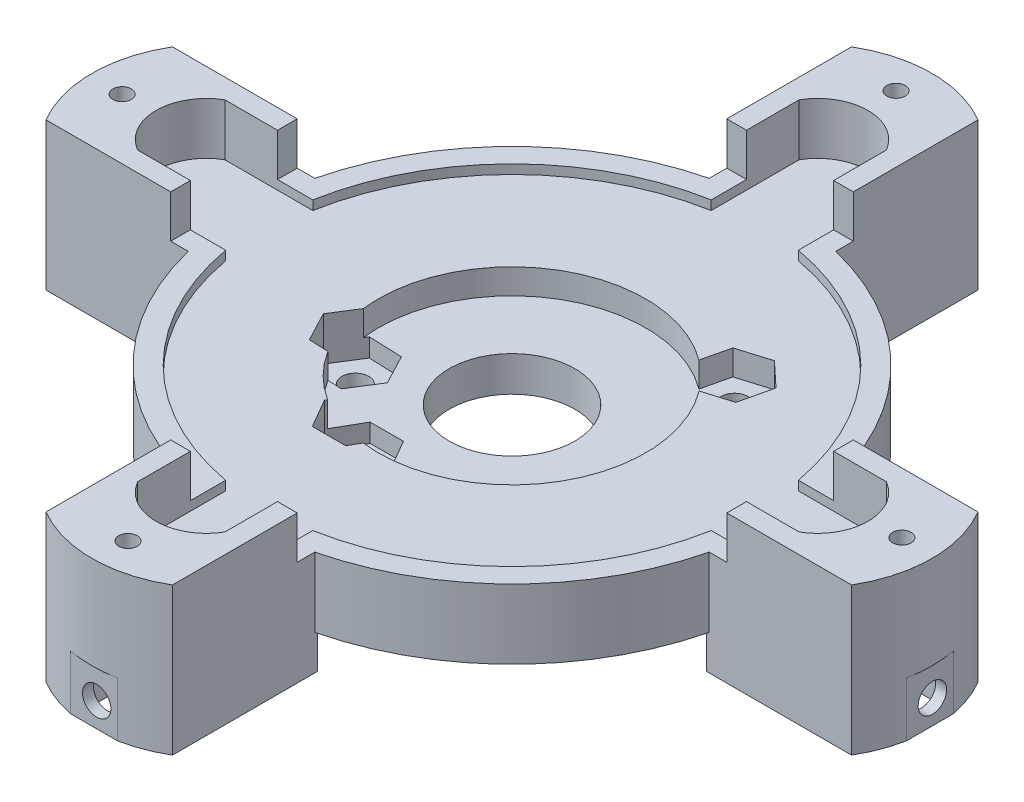
from build123d import *

# Parameters (mm, degrees)
SKETCH1_R                = 32
BOSS_EXTRUDE1_DEPTH      = 8.3
BOSS_EXTRUDE2_DEPTH      = 5.1
BOSS_EXTRUDE2_DEPTH_BACK = 12.5
CUT_EXTRUDE1_START       = -1.1
CUT_EXTRUDE1_DEPTH       = 6.2
SKETCH3_R                = 15.95
CUT_EXTRUDE2_DEPTH       = 3
CUT_EXTRUDE3_REACH       = 73.529
SKETCH4_R                = 7.5
CUT_EXTRUDE4_DEPTH       = 3
CUT_EXTRUDE5_REACH       = 74.189
SKETCH5_3_R              = 1.6
CUT_EXTRUDE6_DEPTH       = 3
CUT_EXTRUDE7_START       = -2.2
CUT_EXTRUDE7_DEPTH       = 5.2
SKETCH10_W               = 66.4
SKETCH10_H               = 66.4
CUT_EXTRUDE8_DEPTH       = 5.1
CUT_EXTRUDE9_REACH       = 75.085
SKETCH11_R               = 1.1
SKETCH12_W               = 4.8
SKETCH12_H               = 5.3
SKETCH12_W_2             = 5.3
SKETCH12_H_2             = 4.8
CUT_EXTRUDE10_DEPTH      = 12.6
SKETCH13_W               = 6.3
SKETCH13_H               = 2.5
SKETCH13_W_2             = 2.5
SKETCH13_H_2             = 6.3
CUT_EXTRUDE11_DEPTH      = 6.5
SKETCH14_R               = 1.7
CUT_EXTRUDE12_DEPTH      = 3.5
SKETCH15_W               = 6.3
SKETCH15_H               = 2.5
CUT_EXTRUDE13_DEPTH      = 7.6
CIRPATTERN1_COUNT        = 4
CUT_EXTRUDE14_DEPTH      = 6.5
SKETCH17_R               = 1.7
CUT_EXTRUDE15_DEPTH      = 9
CIRPATTERN9_COUNT        = 4


with BuildPart() as part:
    # Sketch1 → Boss-Extrude1 (new body)
    with BuildSketch(Plane(origin=(0, 0, 0), x_dir=(1, 0, 0), z_dir=(0, 1, 0))):
        with Locations(Location((0, 0, 0), (0, 0, 90))):
            Circle(SKETCH1_R)
    extrude(amount=BOSS_EXTRUDE1_DEPTH)

    # Sketch6 → Boss-Extrude2 (add, two sides: drawn at the far end of the back side and taken through both)
    with BuildSketch(Plane(origin=(0, 8.3, 0), x_dir=(1, 0, 0), z_dir=(0, 1, 0)).offset(-BOSS_EXTRUDE2_DEPTH_BACK)):
        with BuildLine():
            Line((-7.55, 48.087781667), (-7.55, 30.787781667))
            Line((-7.55, 30.787781667), (7.55, 30.787781667))
            Line((7.55, 30.787781667), (7.55, 48.087781667))
            ThreePointArc((7.55, 48.087781667), (0, 50.158386552), (-7.55, 48.087781667))
        make_face()
        with BuildLine():
            Line((30.787781667, 7.55), (30.787781667, -7.55))
            Line((30.787781667, -7.55), (48.087781667, -7.55))
            ThreePointArc((48.087781667, -7.55), (50.158386552, 0), (48.087781667, 7.55))
            Line((48.087781667, 7.55), (30.787781667, 7.55))
        make_face()
        with BuildLine():
            Line((7.55, -30.787781667), (-7.55, -30.787781667))
            Line((-7.55, -30.787781667), (-7.55, -48.087781667))
            ThreePointArc((-7.55, -48.087781667), (0, -50.158386552), (7.55, -48.087781667))
            Line((7.55, -48.087781667), (7.55, -30.787781667))
        make_face()
        with BuildLine():
            Line((-30.787781667, -7.55), (-30.787781667, 7.55))
            Line((-30.787781667, 7.55), (-48.087781667, 7.55))
            ThreePointArc((-48.087781667, 7.55), (-50.158386552, 0), (-48.087781667, -7.55))
            Line((-48.087781667, -7.55), (-30.787781667, -7.55))
        make_face()
    extrude(amount=BOSS_EXTRUDE2_DEPTH + BOSS_EXTRUDE2_DEPTH_BACK)

    # Sketch2 → Cut-Extrude1 (cut)
    with BuildSketch(Plane(origin=(0, 8.3, 0), x_dir=(1, 0, 0), z_dir=(0, 1, 0)).offset(CUT_EXTRUDE1_START)):
        with BuildLine():
            Line((28.987281694, -5.2), (39.487281694, -5.2))
            ThreePointArc((39.487281694, -5.2), (42.493955784, 0), (39.487281694, 5.2))
            Line((39.487281694, 5.2), (28.987281694, 5.2))
            ThreePointArc((28.987281694, 5.2), (20.824294706, 20.824294706), (5.2, 28.987281694))
            Line((5.2, 28.987281694), (5.2, 39.487281694))
            ThreePointArc((5.2, 39.487281694), (0, 42.493955784), (-5.2, 39.487281694))
            Line((-5.2, 39.487281694), (-5.2, 28.987281694))
            ThreePointArc((-5.2, 28.987281694), (-20.824294706, 20.824294706), (-28.987281694, 5.2))
            Line((-28.987281694, 5.2), (-39.487281694, 5.2))
            ThreePointArc((-39.487281694, 5.2), (-42.493955784, 0), (-39.487281694, -5.2))
            Line((-39.487281694, -5.2), (-28.987281694, -5.2))
            ThreePointArc((-28.987281694, -5.2), (-20.824294706, -20.824294706), (-5.2, -28.987281694))
            Line((-5.2, -28.987281694), (-5.2, -39.487281694))
            ThreePointArc((-5.2, -39.487281694), (0, -42.493955784), (5.2, -39.487281694))
            Line((5.2, -39.487281694), (5.2, -28.987281694))
            ThreePointArc((5.2, -28.987281694), (20.824294706, -20.824294706), (28.987281694, -5.2))
        make_face()
    extrude(amount=CUT_EXTRUDE1_DEPTH, mode=Mode.SUBTRACT)

    # Sketch3 → Cut-Extrude2 (cut)
    with BuildSketch(Plane(origin=(0, 7.2, 0), x_dir=(1, 0, 0), z_dir=(0, 1, 0))):
        with Locations(Location((0, 0, 0), (0, 0, 270))):
            Circle(SKETCH3_R)
    extrude(amount=-CUT_EXTRUDE2_DEPTH, mode=Mode.SUBTRACT)

    # Sketch4 → Cut-Extrude3 (cut, up to next)
    with BuildSketch(Plane(origin=(0, 4.2, 0), x_dir=(1, 0, 0), z_dir=(0, 1, 0)), mode=Mode.PRIVATE) as cut_extrude3_sk1:
        with Locations(Location((0, 0, 0), (0, 0, 270))):
            Circle(SKETCH4_R)
    cut_extrude3_tool1 = extrude(cut_extrude3_sk1.sketch, amount=-CUT_EXTRUDE3_REACH, mode=Mode.PRIVATE) & part.part
    add(cut_extrude3_tool1.solids().sort_by_distance((0, 4.2, 0))[0], mode=Mode.SUBTRACT)

    # Sketch5 → Cut-Extrude4 (cut)
    # profile 1 of 5: a face of its own
    with BuildSketch(Plane.XZ):
        with BuildLine():
            Line((30.787781667, -7.55), (30.787781667, 7.55))
            ThreePointArc((30.787781667, 7.55), (22.415284964, 22.415284964), (7.55, 30.787781667))
            Line((7.55, 30.787781667), (-7.55, 30.787781667))
            ThreePointArc((-7.55, 30.787781667), (-22.415284964, 22.415284964), (-30.787781667, 7.55))
            Line((-30.787781667, 7.55), (-30.787781667, -7.55))
            ThreePointArc((-30.787781667, -7.55), (-22.415284964, -22.415284964), (-7.55, -30.787781667))
            Line((-7.55, -30.787781667), (7.55, -30.787781667))
            ThreePointArc((7.55, -30.787781667), (22.415284964, -22.415284964), (30.787781667, -7.55))
        make_face()
        with BuildLine():
            Line((-19.75, 4.693346354), (-19.75, 19.75))
            Line((-19.75, 19.75), (-4.693346354, 19.75))
            ThreePointArc((-4.693346354, 19.75), (0, 20.3), (4.693346354, 19.75))
            Line((4.693346354, 19.75), (19.75, 19.75))
            Line((19.75, 19.75), (19.75, 4.693346354))
            ThreePointArc((19.75, 4.693346354), (20.162031148, 2.36273147), (20.3, 0))
            ThreePointArc((20.3, 0), (20.162031148, -2.36273147), (19.75, -4.693346354))
            Line((19.75, -4.693346354), (19.75, -19.75))
            Line((19.75, -19.75), (4.693346354, -19.75))
            ThreePointArc((4.693346354, -19.75), (0, -20.3), (-4.693346354, -19.75))
            Line((-4.693346354, -19.75), (-19.75, -19.75))
            Line((-19.75, -19.75), (-19.75, -4.693346354))
            ThreePointArc((-19.75, -4.693346354), (-20.3, 0), (-19.75, 4.693346354))
        make_face(mode=Mode.SUBTRACT)
    # profile 2 of 5: a face of its own
    with BuildSketch(Plane.XZ):
        with BuildLine():
            ThreePointArc((-4.693346354, -19.75), (-14.354267658, -14.354267658), (-19.75, -4.693346354))
            Line((-19.75, -4.693346354), (-19.75, -19.75))
            Line((-19.75, -19.75), (-4.693346354, -19.75))
        make_face()
    # profile 3 of 5: a face of its own
    with BuildSketch(Plane.XZ):
        with BuildLine():
            Line((19.75, -19.75), (19.75, -4.693346354))
            ThreePointArc((19.75, -4.693346354), (18.875180628, -7.471114794), (17.611887401, -10.095118731))
            ThreePointArc((17.611887401, -10.095118731), (17.866890834, -11.077364606), (17.95271031, -12.088536563))
            ThreePointArc((17.95271031, -12.088536563), (15.391939565, -17.005009092), (9.895476267, -17.724828615))
            ThreePointArc((9.895476267, -17.724828615), (7.364357824, -18.917088408), (4.693346354, -19.75))
            Line((4.693346354, -19.75), (19.75, -19.75))
        make_face()
    # profile 4 of 5: a face of its own
    with BuildSketch(Plane.XZ):
        with BuildLine():
            Line((19.75, 19.75), (4.693346354, 19.75))
            ThreePointArc((4.693346354, 19.75), (14.354267658, 14.354267658), (19.75, 4.693346354))
            Line((19.75, 4.693346354), (19.75, 19.75))
        make_face()
    # profile 5 of 5: a face of its own
    with BuildSketch(Plane.XZ):
        with BuildLine():
            Line((-4.693346354, 19.75), (-19.75, 19.75))
            Line((-19.75, 19.75), (-19.75, 4.693346354))
            ThreePointArc((-19.75, 4.693346354), (-14.354267658, 14.354267658), (-4.693346354, 19.75))
        make_face()
    extrude(amount=-CUT_EXTRUDE4_DEPTH, mode=Mode.SUBTRACT)

    # Sketch5<3> → Cut-Extrude5 (cut, up to next)
    with BuildSketch(Plane.XZ, mode=Mode.PRIVATE) as cut_extrude5_sk1:
        with Locations(Location((13.2, -13.35, 0), (0, 0, 270))):
            Circle(SKETCH5_3_R)
    cut_extrude5_tool1 = extrude(cut_extrude5_sk1.sketch, amount=-CUT_EXTRUDE5_REACH, mode=Mode.PRIVATE) & part.part
    # Sketch5<3> → Cut-Extrude5 (cut, up to next)
    with BuildSketch(Plane.XZ, mode=Mode.PRIVATE) as cut_extrude5_sk2:
        with Locations(Location((-4.7, 13.7, 0), (0, 0, 270))):
            Circle(SKETCH5_3_R)
    cut_extrude5_tool2 = extrude(cut_extrude5_sk2.sketch, amount=-CUT_EXTRUDE5_REACH, mode=Mode.PRIVATE) & part.part
    # Sketch5<3> → Cut-Extrude5 (cut, up to next)
    with BuildSketch(Plane.XZ, mode=Mode.PRIVATE) as cut_extrude5_sk3:
        with Locations(Location((-13.7, 5, 0), (0, 0, 270))):
            Circle(SKETCH5_3_R)
    cut_extrude5_tool3 = extrude(cut_extrude5_sk3.sketch, amount=-CUT_EXTRUDE5_REACH, mode=Mode.PRIVATE) & part.part
    add(cut_extrude5_tool1.solids().sort_by_distance((13.2, 0, -13.35))[0], mode=Mode.SUBTRACT)
    add(cut_extrude5_tool2.solids().sort_by_distance((-4.7, 0, 13.7))[0], mode=Mode.SUBTRACT)
    add(cut_extrude5_tool3.solids().sort_by_distance((-13.7, 0, 5))[0], mode=Mode.SUBTRACT)

    # Sketch7 → Cut-Extrude6 (cut)
    with BuildSketch(Plane(origin=(0, 7.2, 0), x_dir=(1, 0, 0), z_dir=(0, 1, 0))):
        Polygon((10.290460821, 16.071136117), (9.388657406, 12.190833216), (12.298196585, 9.469697099), (16.109539179, 10.628863883), (17.011342594, 14.509166784), (14.101803415, 17.230302901), align=None)
    extrude(amount=-CUT_EXTRUDE6_DEPTH, mode=Mode.SUBTRACT)

    # Sketch9 → Cut-Extrude7 (cut)
    with BuildSketch(Plane(origin=(0, 4.2, 0), x_dir=(1, 0, 0), z_dir=(0, 1, 0)).offset(CUT_EXTRUDE7_START)):
        Polygon((-6.697570586, -10.253304227), (-8.683711392, -13.706598987), (-6.686140806, -17.15329476), (-2.702429414, -17.146695773), (-0.716288608, -13.693401013), (-2.713859194, -10.24670524), align=None)
        Polygon((-11.578388784, -1.628239948), (-15.559224253, -1.476750764), (-17.680835468, -4.848510816), (-15.821611216, -8.371760052), (-11.840775747, -8.523249236), (-9.719164532, -5.151489184), align=None)
    extrude(amount=CUT_EXTRUDE7_DEPTH, mode=Mode.SUBTRACT)

    # Sketch10 → Cut-Extrude8 (cut)
    with BuildSketch(Plane(origin=(0, 8.3, 0), x_dir=(1, 0, 0), z_dir=(0, 1, 0))):
        Rectangle(SKETCH10_W, SKETCH10_H)
    extrude(amount=CUT_EXTRUDE8_DEPTH, mode=Mode.SUBTRACT)

    # Sketch11 → Cut-Extrude9 (cut, up to next)
    with BuildSketch(Plane(origin=(0, 13.4, 0), x_dir=(1, 0, 0), z_dir=(0, 1, 0)), mode=Mode.PRIVATE) as cut_extrude9_sk1:
        with Locations(Location((0.35, -46.2, 0), (0, 0, 270))):
            Circle(SKETCH11_R)
    cut_extrude9_tool1 = extrude(cut_extrude9_sk1.sketch, amount=-CUT_EXTRUDE9_REACH, mode=Mode.PRIVATE) & part.part
    # Sketch11 → Cut-Extrude9 (cut, up to next)
    with BuildSketch(Plane(origin=(0, 13.4, 0), x_dir=(1, 0, 0), z_dir=(0, 1, 0)), mode=Mode.PRIVATE) as cut_extrude9_sk2:
        with Locations(Location((-46.2, -0.35, 0), (0, 0, 270))):
            Circle(SKETCH11_R)
    cut_extrude9_tool2 = extrude(cut_extrude9_sk2.sketch, amount=-CUT_EXTRUDE9_REACH, mode=Mode.PRIVATE) & part.part
    # Sketch11 → Cut-Extrude9 (cut, up to next)
    with BuildSketch(Plane(origin=(0, 13.4, 0), x_dir=(1, 0, 0), z_dir=(0, 1, 0)), mode=Mode.PRIVATE) as cut_extrude9_sk3:
        with Locations(Location((-0.35, 46.2, 0), (0, 0, 270))):
            Circle(SKETCH11_R)
    cut_extrude9_tool3 = extrude(cut_extrude9_sk3.sketch, amount=-CUT_EXTRUDE9_REACH, mode=Mode.PRIVATE) & part.part
    # Sketch11 → Cut-Extrude9 (cut, up to next)
    with BuildSketch(Plane(origin=(0, 13.4, 0), x_dir=(1, 0, 0), z_dir=(0, 1, 0)), mode=Mode.PRIVATE) as cut_extrude9_sk4:
        with Locations(Location((46.2, 0.35, 0), (0, 0, 270))):
            Circle(SKETCH11_R)
    cut_extrude9_tool4 = extrude(cut_extrude9_sk4.sketch, amount=-CUT_EXTRUDE9_REACH, mode=Mode.PRIVATE) & part.part
    add(cut_extrude9_tool1.solids().sort_by_distance((0.35, 13.4, 46.2))[0], mode=Mode.SUBTRACT)
    add(cut_extrude9_tool2.solids().sort_by_distance((-46.2, 13.4, 0.35))[0], mode=Mode.SUBTRACT)
    add(cut_extrude9_tool3.solids().sort_by_distance((-0.35, 13.4, -46.2))[0], mode=Mode.SUBTRACT)
    add(cut_extrude9_tool4.solids().sort_by_distance((46.2, 13.4, -0.35))[0], mode=Mode.SUBTRACT)

    # Sketch12 → Cut-Extrude10 (cut)
    with BuildSketch(Plane.XZ.offset(4.2)):
        with Locations((-46.187781667, 0.3)):
            Rectangle(SKETCH12_W, SKETCH12_H)
        with Locations((0.3, 46.187781667)):
            Rectangle(SKETCH12_W_2, SKETCH12_H_2)
        with Locations((46.187781667, -0.3)):
            Rectangle(SKETCH12_W, SKETCH12_H)
        with Locations((-0.3, -46.187781667)):
            Rectangle(SKETCH12_W_2, SKETCH12_H_2)
    extrude(amount=-CUT_EXTRUDE10_DEPTH, mode=Mode.SUBTRACT)

    # Sketch13 → Cut-Extrude11 (cut)
    with BuildSketch(Plane.XZ.offset(4.2)):
        with Locations((0.3, 40.537781667)):
            Rectangle(SKETCH13_W, SKETCH13_H)
        with Locations((40.537781667, -0.3)):
            Rectangle(SKETCH13_W_2, SKETCH13_H_2)
        with Locations((-0.3, -40.537781667)):
            Rectangle(SKETCH13_W, SKETCH13_H)
        with Locations((-40.537781667, 0.3)):
            Rectangle(SKETCH13_W_2, SKETCH13_H_2)
    extrude(amount=-CUT_EXTRUDE11_DEPTH, mode=Mode.SUBTRACT)

    # Sketch14 → Cut-Extrude12 (cut)
    with BuildSketch(Plane.XZ.offset(4.2)):
        with Locations(Location((0.35, 34.887781667, 0), (0, 0, 270))):
            Circle(SKETCH14_R)
        with Locations(Location((34.887781667, -0.35, 0), (0, 0, 270))):
            Circle(SKETCH14_R)
        with Locations(Location((-0.35, -34.887781667, 0), (0, 0, 270))):
            Circle(SKETCH14_R)
        with Locations(Location((-34.887781667, 0.35, 0), (0, 0, 270))):
            Circle(SKETCH14_R)
    extrude(amount=-CUT_EXTRUDE12_DEPTH, mode=Mode.SUBTRACT)

    # Sketch15 → Cut-Extrude13 (cut)
    with BuildSketch(Plane(origin=(-30.787781667, 0, 0), x_dir=(0, 0, -1), z_dir=(1, 0, 0))):
        with Locations((-0.3, 0.55)):
            Rectangle(SKETCH15_W, SKETCH15_H)
    cut_extrude13 = extrude(amount=-CUT_EXTRUDE13_DEPTH, mode=Mode.SUBTRACT)

    # CirPattern1: Cut-Extrude13 ×4 about axis
    cirpattern1_axis = Axis((0, 0, 0), (0, 1, 0))
    for i in range(1, CIRPATTERN1_COUNT):
        add(cut_extrude13.rotate(cirpattern1_axis, i * 360 / CIRPATTERN1_COUNT), mode=Mode.SUBTRACT)

    # Sketch16 → Cut-Extrude14 (cut)
    with BuildSketch(Plane.XZ.offset(4.2)):
        with BuildLine():
            Line((49.891108252, 2.8), (49.891108252, -2.8))
            ThreePointArc((49.891108252, -2.8), (50.158386552, 0), (49.891108252, 2.8))
        make_face()
        with BuildLine():
            Line((2.8, -49.891108252), (-2.8, -49.891108252))
            ThreePointArc((-2.8, -49.891108252), (0, -50.158386552), (2.8, -49.891108252))
        make_face()
        with BuildLine():
            Line((-49.891108252, -2.8), (-49.891108252, 2.8))
            ThreePointArc((-49.891108252, 2.8), (-50.158386552, 0), (-49.891108252, -2.8))
        make_face()
        with BuildLine():
            Line((-2.8, 49.891108252), (2.8, 49.891108252))
            ThreePointArc((2.8, 49.891108252), (0, 50.158386552), (-2.8, 49.891108252))
        make_face()
    extrude(amount=-CUT_EXTRUDE14_DEPTH, mode=Mode.SUBTRACT)

    # Sketch17 → Cut-Extrude15 (cut)
    with BuildSketch(Plane(origin=(49.891108252, 0, 0), x_dir=(0, 0, -1), z_dir=(1, 0, 0))):
        with Locations((0.3, -1.3)):
            Circle(SKETCH17_R)
    cut_extrude15 = extrude(amount=-CUT_EXTRUDE15_DEPTH, mode=Mode.SUBTRACT)

    # CirPattern9: Cut-Extrude15 ×4 about axis
    cirpattern9_axis = Axis((0, 0, 0), (0, 1, 0))
    for i in range(1, CIRPATTERN9_COUNT):
        add(cut_extrude15.rotate(cirpattern9_axis, i * 360 / CIRPATTERN9_COUNT), mode=Mode.SUBTRACT)


solid = part.part
